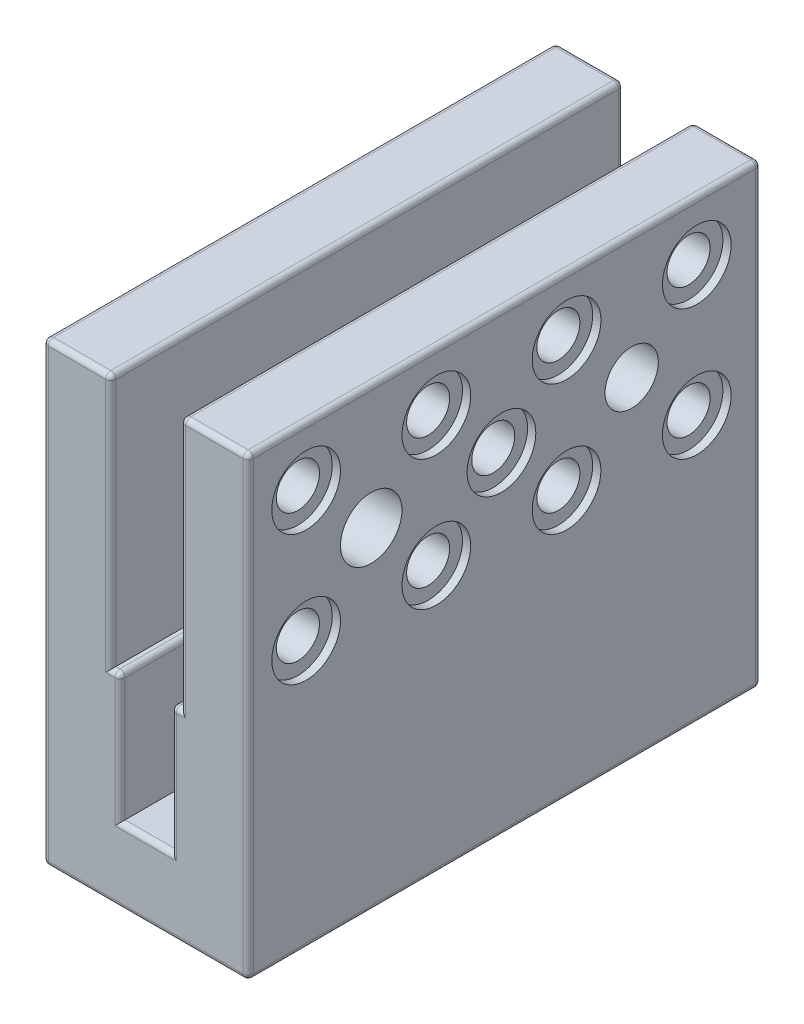
from build123d import *

# Parameters (mm, degrees)
SKETCH2_W           = 20
SKETCH2_H           = 50
BOSS_EXTRUDE1_DEPTH = 44.5
SKETCH3_W           = 6.8
SKETCH3_H           = 24.75
SKETCH3_W_2         = 5
SKETCH3_H_2         = 12.5
CUT_EXTRUDE3_DEPTH  = 68.677544282
SKETCH4_R           = 3
SKETCH4_R_2         = 2.6
CUT_EXTRUDE4_DEPTH  = 55.820160525
CUT_EXTRUDE5_REACH  = 56.82
SKETCH4_3_R         = 2.1
BOSS_EXTRUDE2_START = -6.6
SKETCH5_R           = 3
SKETCH5_R_2         = 2.6
BOSS_EXTRUDE2_DEPTH = 6.6
SKETCH6_R           = 3.1
CUT_EXTRUDE6_DEPTH  = 1.23
SKETCH7_W           = 4.6
SKETCH7_H           = 20.1
CUT_EXTRUDE7_DEPTH  = 3.25
FILLET1_R           = 0.5
SKETCH8_R           = 3.35
CUT_EXTRUDE8_DEPTH  = 0.8


with BuildPart() as part:
    # Sketch2 → Boss-Extrude1 (new body)
    with BuildSketch(Plane(origin=(0, 0, 0), x_dir=(1, 0, 0), z_dir=(0, 1, 0))):
        Rectangle(SKETCH2_W, SKETCH2_H)
    extrude(amount=BOSS_EXTRUDE1_DEPTH)

    # Sketch3 → Cut-Extrude3 (cut, through all)
    with BuildSketch(Plane.XY.offset(25)):
        with Locations((0, 32.125)):
            Rectangle(SKETCH3_W, SKETCH3_H)
        with Locations((0, 13.5)):
            Rectangle(SKETCH3_W_2, SKETCH3_H_2)
    extrude(amount=-CUT_EXTRUDE3_DEPTH, mode=Mode.SUBTRACT)

    # Sketch4 → Cut-Extrude4 (cut, through all)
    with BuildSketch(Plane(origin=(10, 0, 0), x_dir=(0, 0, -1), z_dir=(1, 0, 0))):
        with Locations((-13, 32.41)):
            Circle(SKETCH4_R)
        with Locations((12.4, 32.41)):
            Circle(SKETCH4_R_2)
    extrude(amount=-CUT_EXTRUDE4_DEPTH, mode=Mode.SUBTRACT)

    # Sketch4<3> → Cut-Extrude5 (cut, up to next)
    with BuildSketch(Plane(origin=(10, 0, 0), x_dir=(0, 0, -1), z_dir=(1, 0, 0)), mode=Mode.PRIVATE) as cut_extrude5_sk1:
        with Locations((-0.3, 32.41)):
            Circle(SKETCH4_3_R)
    cut_extrude5_tool1 = extrude(cut_extrude5_sk1.sketch, amount=-CUT_EXTRUDE5_REACH, mode=Mode.PRIVATE) & part.part
    # Sketch4<3> → Cut-Extrude5 (cut, up to next)
    with BuildSketch(Plane(origin=(10, 0, 0), x_dir=(0, 0, -1), z_dir=(1, 0, 0)), mode=Mode.PRIVATE) as cut_extrude5_sk2:
        with Locations((-19.35, 38.76)):
            Circle(SKETCH4_3_R)
    cut_extrude5_tool2 = extrude(cut_extrude5_sk2.sketch, amount=-CUT_EXTRUDE5_REACH, mode=Mode.PRIVATE) & part.part
    # Sketch4<3> → Cut-Extrude5 (cut, up to next)
    with BuildSketch(Plane(origin=(10, 0, 0), x_dir=(0, 0, -1), z_dir=(1, 0, 0)), mode=Mode.PRIVATE) as cut_extrude5_sk3:
        with Locations((-6.65, 38.76)):
            Circle(SKETCH4_3_R)
    cut_extrude5_tool3 = extrude(cut_extrude5_sk3.sketch, amount=-CUT_EXTRUDE5_REACH, mode=Mode.PRIVATE) & part.part
    # Sketch4<3> → Cut-Extrude5 (cut, up to next)
    with BuildSketch(Plane(origin=(10, 0, 0), x_dir=(0, 0, -1), z_dir=(1, 0, 0)), mode=Mode.PRIVATE) as cut_extrude5_sk4:
        with Locations((6.05, 38.76)):
            Circle(SKETCH4_3_R)
    cut_extrude5_tool4 = extrude(cut_extrude5_sk4.sketch, amount=-CUT_EXTRUDE5_REACH, mode=Mode.PRIVATE) & part.part
    # Sketch4<3> → Cut-Extrude5 (cut, up to next)
    with BuildSketch(Plane(origin=(10, 0, 0), x_dir=(0, 0, -1), z_dir=(1, 0, 0)), mode=Mode.PRIVATE) as cut_extrude5_sk5:
        with Locations((18.75, 38.76)):
            Circle(SKETCH4_3_R)
    cut_extrude5_tool5 = extrude(cut_extrude5_sk5.sketch, amount=-CUT_EXTRUDE5_REACH, mode=Mode.PRIVATE) & part.part
    # Sketch4<3> → Cut-Extrude5 (cut, up to next)
    with BuildSketch(Plane(origin=(10, 0, 0), x_dir=(0, 0, -1), z_dir=(1, 0, 0)), mode=Mode.PRIVATE) as cut_extrude5_sk6:
        with Locations((18.75, 26.06)):
            Circle(SKETCH4_3_R)
    cut_extrude5_tool6 = extrude(cut_extrude5_sk6.sketch, amount=-CUT_EXTRUDE5_REACH, mode=Mode.PRIVATE) & part.part
    # Sketch4<3> → Cut-Extrude5 (cut, up to next)
    with BuildSketch(Plane(origin=(10, 0, 0), x_dir=(0, 0, -1), z_dir=(1, 0, 0)), mode=Mode.PRIVATE) as cut_extrude5_sk7:
        with Locations((6.05, 26.06)):
            Circle(SKETCH4_3_R)
    cut_extrude5_tool7 = extrude(cut_extrude5_sk7.sketch, amount=-CUT_EXTRUDE5_REACH, mode=Mode.PRIVATE) & part.part
    # Sketch4<3> → Cut-Extrude5 (cut, up to next)
    with BuildSketch(Plane(origin=(10, 0, 0), x_dir=(0, 0, -1), z_dir=(1, 0, 0)), mode=Mode.PRIVATE) as cut_extrude5_sk8:
        with Locations((-6.65, 26.06)):
            Circle(SKETCH4_3_R)
    cut_extrude5_tool8 = extrude(cut_extrude5_sk8.sketch, amount=-CUT_EXTRUDE5_REACH, mode=Mode.PRIVATE) & part.part
    # Sketch4<3> → Cut-Extrude5 (cut, up to next)
    with BuildSketch(Plane(origin=(10, 0, 0), x_dir=(0, 0, -1), z_dir=(1, 0, 0)), mode=Mode.PRIVATE) as cut_extrude5_sk9:
        with Locations((-19.35, 26.06)):
            Circle(SKETCH4_3_R)
    cut_extrude5_tool9 = extrude(cut_extrude5_sk9.sketch, amount=-CUT_EXTRUDE5_REACH, mode=Mode.PRIVATE) & part.part
    add(cut_extrude5_tool1.solids().sort_by_distance((10, 32.41, 0.3))[0], mode=Mode.SUBTRACT)
    add(cut_extrude5_tool2.solids().sort_by_distance((10, 38.76, 19.35))[0], mode=Mode.SUBTRACT)
    add(cut_extrude5_tool3.solids().sort_by_distance((10, 38.76, 6.65))[0], mode=Mode.SUBTRACT)
    add(cut_extrude5_tool4.solids().sort_by_distance((10, 38.76, -6.05))[0], mode=Mode.SUBTRACT)
    add(cut_extrude5_tool5.solids().sort_by_distance((10, 38.76, -18.75))[0], mode=Mode.SUBTRACT)
    add(cut_extrude5_tool6.solids().sort_by_distance((10, 26.06, -18.75))[0], mode=Mode.SUBTRACT)
    add(cut_extrude5_tool7.solids().sort_by_distance((10, 26.06, -6.05))[0], mode=Mode.SUBTRACT)
    add(cut_extrude5_tool8.solids().sort_by_distance((10, 26.06, 6.65))[0], mode=Mode.SUBTRACT)
    add(cut_extrude5_tool9.solids().sort_by_distance((10, 26.06, 19.35))[0], mode=Mode.SUBTRACT)

    # Sketch5 → Boss-Extrude2 (add)
    with BuildSketch(Plane.ZY.offset(10).offset(BOSS_EXTRUDE2_START)):
        with Locations((13, 32.41)):
            Circle(SKETCH5_R)
        with Locations((13, 32.41)):
            Circle(SKETCH5_R_2, mode=Mode.SUBTRACT)
    extrude(amount=BOSS_EXTRUDE2_DEPTH)

    # Sketch6 → Cut-Extrude6 (cut)
    with BuildSketch(Plane.ZY.offset(-3.4)):
        with Locations((-18.75, 26.06)):
            Circle(SKETCH6_R)
        with Locations((-18.75, 38.76)):
            Circle(SKETCH6_R)
        with Locations((-6.05, 38.76)):
            Circle(SKETCH6_R)
        with Locations((6.65, 38.76)):
            Circle(SKETCH6_R)
        with Locations((0.3, 32.41)):
            Circle(SKETCH6_R)
        with Locations((-6.05, 26.06)):
            Circle(SKETCH6_R)
        with Locations((6.65, 26.06)):
            Circle(SKETCH6_R)
        with Locations((19.35, 26.06)):
            Circle(SKETCH6_R)
        with Locations((19.35, 38.76)):
            Circle(SKETCH6_R)
    extrude(amount=-CUT_EXTRUDE6_DEPTH, mode=Mode.SUBTRACT)

    # Sketch7 → Cut-Extrude7 (cut)
    with BuildSketch(Plane.ZY.offset(10)):
        with Locations((-16.3, 13.53)):
            Rectangle(SKETCH7_W, SKETCH7_H)
    extrude(amount=-CUT_EXTRUDE7_DEPTH, mode=Mode.SUBTRACT)

    # Fillet1
    fillet1_edges = [part.edges().sort_by_distance(p)[0] for p in [
        (-10, 0, 0),
        (10, 0, 0),
        (-10, 22.25, -25),
        (0, 0, -25),
        (10, 22.25, -25),
        (3.4, 32.125, -25),
        (2.95, 19.75, -25),
        (2.5, 13.5, -25),
        (0, 7.25, -25),
        (-2.5, 13.5, -25),
        (-2.95, 19.75, -25),
        (-3.4, 32.125, -25),
        (-2.5, 13.5, 25),
        (0, 7.25, 25),
        (2.5, 13.5, 25),
        (2.95, 19.75, 25),
        (3.4, 32.125, 25),
        (10, 22.25, 25),
        (0, 0, 25),
        (-10, 22.25, 25),
        (-3.4, 32.125, 25),
        (-2.95, 19.75, 25),
        (10, 44.5, 0),
        (6.7, 44.5, 25),
        (3.4, 44.5, 0),
        (6.7, 44.5, -25),
        (-6.7, 44.5, 25),
        (-10, 44.5, 0),
        (-6.7, 44.5, -25),
        (-3.4, 44.5, 0),
        (2.5, 19.75, 0),
        (-2.5, 19.75, 0),
    ]]
    fillet(fillet1_edges, radius=FILLET1_R)

    # Sketch8 → Cut-Extrude8 (cut)
    with BuildSketch(Plane(origin=(10, 0, 0), x_dir=(0, 0, -1), z_dir=(1, 0, 0))):
        with Locations((-19.35, 38.76)):
            Circle(SKETCH8_R)
        with Locations((-6.65, 38.76)):
            Circle(SKETCH8_R)
        with Locations((6.05, 38.76)):
            Circle(SKETCH8_R)
        with Locations((18.75, 38.76)):
            Circle(SKETCH8_R)
        with Locations((-0.3, 32.41)):
            Circle(SKETCH8_R)
        with Locations((-19.35, 26.06)):
            Circle(SKETCH8_R)
        with Locations((-6.65, 26.06)):
            Circle(SKETCH8_R)
        with Locations((6.05, 26.06)):
            Circle(SKETCH8_R)
        with Locations((18.75, 26.06)):
            Circle(SKETCH8_R)
    extrude(amount=-CUT_EXTRUDE8_DEPTH, mode=Mode.SUBTRACT)


solid = part.part
